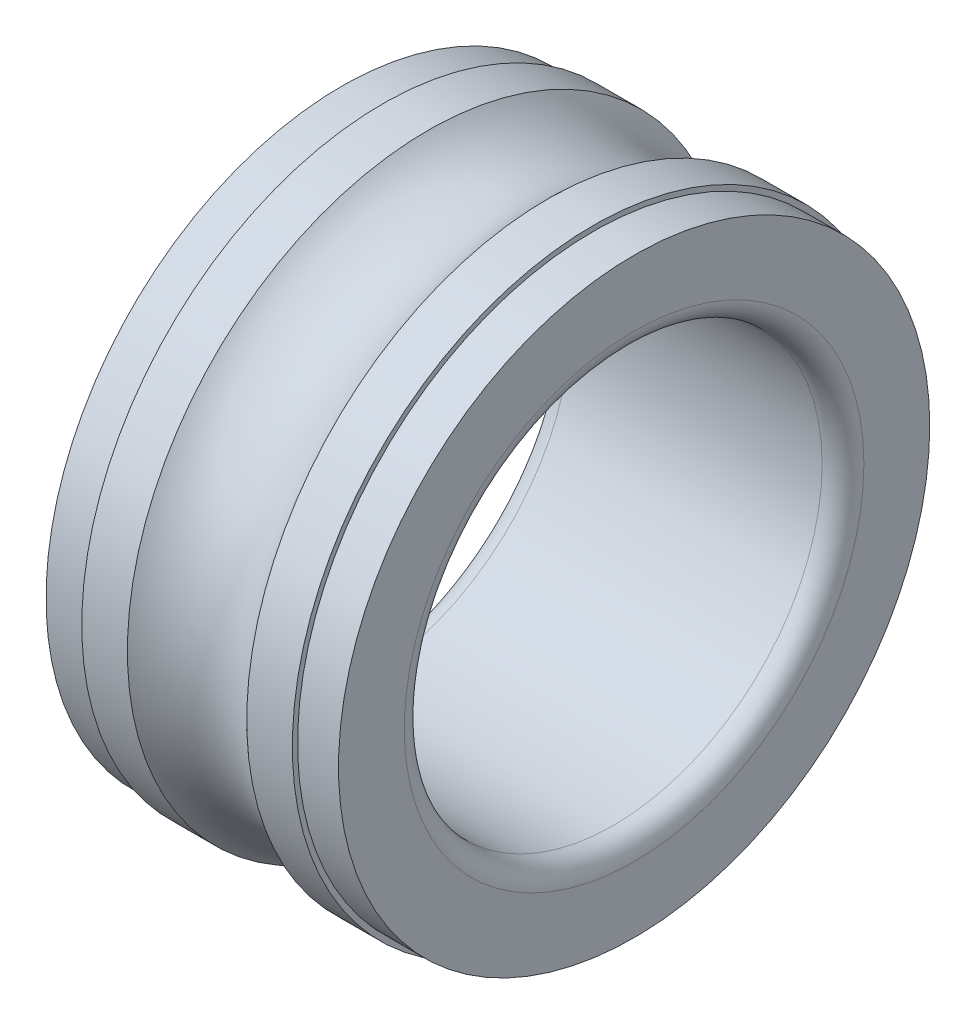
from build123d import *


with BuildPart() as part:
    # Sketch1 → Revolve1 (revolve)
    with BuildSketch(Plane.XY, mode=Mode.PRIVATE) as revolve1_sk:
        with BuildLine():
            Line((-6, 10), (6, 10))
            ThreePointArc((6, 10), (6.707106781, 10.292893219), (7, 11))
            Line((7, 11), (7, 14.15))
            Line((7, 14.15), (5.04, 14.15))
            Line((5.04, 14.15), (5.04, 14.4))
            Line((5.04, 14.4), (2.856571371, 14.4))
            ThreePointArc((2.856571371, 14.4), (0, 13.2), (-2.856571371, 14.4))
            Line((-2.856571371, 14.4), (-5.04, 14.4))
            Line((-5.04, 14.4), (-5.04, 14.15))
            Line((-5.04, 14.15), (-7, 14.15))
            Line((-7, 14.15), (-7, 11))
            ThreePointArc((-7, 11), (-6.707106781, 10.292893219), (-6, 10))
        make_face()
    revolve(revolve1_sk.sketch.rotate(Axis((0, 0, 0), (-1, 0, 0)), 90), axis=Axis((0, 0, 0), (-1, 0, 0)))


solid = part.part
